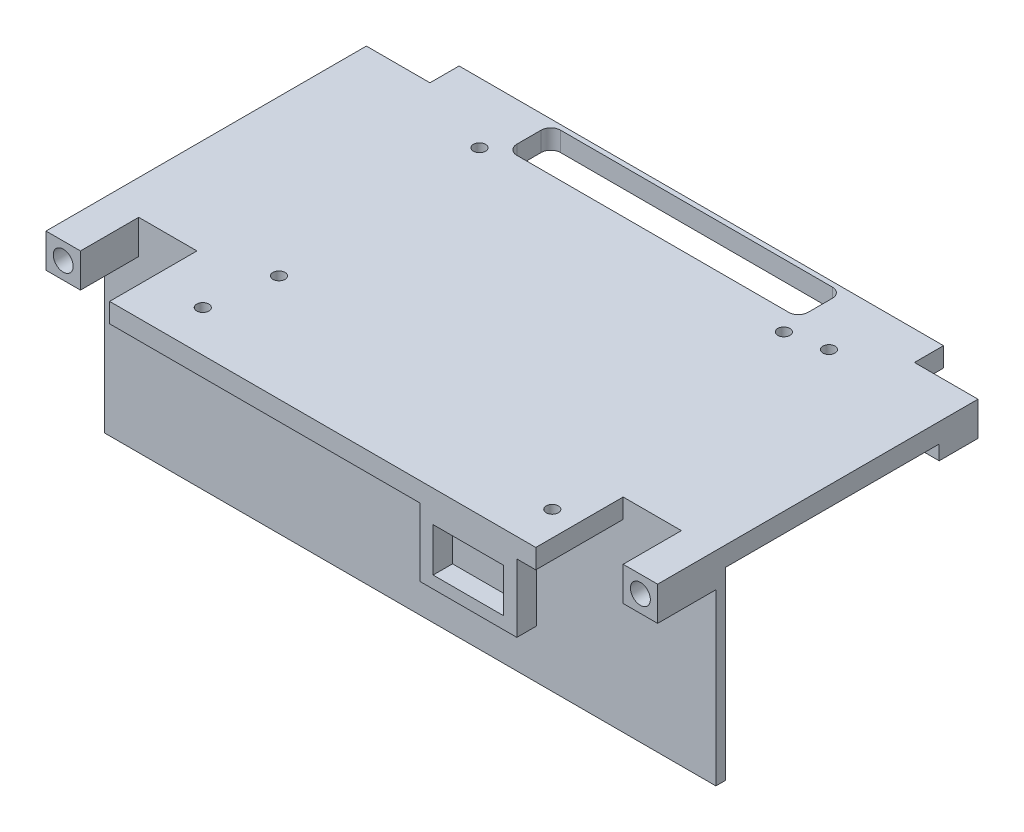
from build123d import *

# Parameters (mm, degrees)
BOSS_EXTRUDE1_DEPTH             = 4
SKETCH3_W                       = 7.1
SKETCH3_H                       = 8
BOSS_EXTRUDE3_DEPTH             = 3
SKETCH4_R                       = 2.05
CUT_EXTRUDE1_DEPTH              = 7
MIRROR2_COPY_1_SKETCH_W         = 7.1
MIRROR2_COPY_1_SKETCH_H         = 8
MIRROR2_COPY_1_DEPTH            = 3
MIRROR2_COPY_2_SKETCH_R         = 2.05
MIRROR2_COPY_2_DEPTH            = 7
SKETCH5_W                       = 60
SKETCH5_H                       = 9
CUT_EXTRUDE2_DEPTH              = 75.953318806
FILLET1_R                       = 2
SKETCH7_W                       = 111.8
SKETCH7_H                       = 1
CUT_EXTRUDE3_DEPTH              = 75.953318806
SKETCH8_W                       = 126
SKETCH8_H                       = 2
BOSS_EXTRUDE4_DEPTH             = 38
SKETCH9_W                       = 12
SKETCH9_H                       = 18
CUT_EXTRUDE4_DEPTH              = 10
SKETCH10_W                      = 7.1
SKETCH10_H                      = 4
BOSS_EXTRUDE5_DEPTH             = 3
SKETCH12_W                      = 1.5
SKETCH12_H                      = 4
BOSS_EXTRUDE6_DEPTH             = 2
SKETCH13_W                      = 40
SKETCH13_H                      = 2
BOSS_EXTRUDE7_DEPTH             = 38
SKETCH14_W                      = 1.5
SKETCH14_H                      = 4
BOSS_EXTRUDE8_DEPTH             = 1
BOSS_EXTRUDE9_REACH             = 85.271
BOSS_EXTRUDE9_DIRECTION_2_REACH = 85.271
SKETCH16_W                      = 20
SKETCH16_H                      = 14
SKETCH16_W_2                    = 14.5
SKETCH16_H_2                    = 9
BOSS_EXTRUDE10_DEPTH            = 4
SKETCH17_W                      = 12
SKETCH17_H                      = 18
CUT_EXTRUDE5_DEPTH              = 84.270643086
SKETCH18_W                      = 6
SKETCH18_H                      = 6
CUT_EXTRUDE6_DEPTH              = 86.170417399
SKETCH22_R                      = 1.25
CUT_EXTRUDE7_DEPTH              = 4
SKETCH25_W                      = 6
SKETCH25_H                      = 38
CUT_EXTRUDE11_DEPTH             = 10
CUT_EXTRUDE12_DEPTH             = 85.029756634
CUT_EXTRUDE12_DEPTH_BACK        = 85.029756634
SKETCH26_W                      = 5.701552738
SKETCH26_H                      = 30.562488548
SKETCH26_W_2                    = 7.53419365
SKETCH26_H_2                    = 28.524331859
SKETCH27_R                      = 1.25
CUT_EXTRUDE13_DEPTH             = 86.170417399


with BuildPart() as part:
    # Sketch1 → Boss-Extrude1 (new body)
    with BuildSketch(Plane(origin=(0, 0, 0), x_dir=(1, 0, 0), z_dir=(0, 1, 0))):
        Polygon((-63, -33), (-55.9, -33), (-55.9, -40), (55.9, -40), (55.9, -33), (63, -33), (63, 33), (55.9, 33), (55.9, 40), (-55.9, 40), (-55.9, 33), (-63, 33), align=None)
    extrude(amount=BOSS_EXTRUDE1_DEPTH)

    # Sketch3 → Boss-Extrude3 (add)
    with BuildSketch(Plane.XZ):
        with Locations((-59.45, -29)):
            Rectangle(SKETCH3_W, SKETCH3_H)
    boss_extrude3 = extrude(amount=BOSS_EXTRUDE3_DEPTH)

    # Sketch4 → Cut-Extrude1 (cut)
    with BuildSketch(Plane(origin=(0, 0, -33), x_dir=(-1, 0, 0), z_dir=(0, 0, -1))):
        with Locations((59.45, 0.5)):
            Circle(SKETCH4_R)
    cut_extrude1 = extrude(amount=-CUT_EXTRUDE1_DEPTH, mode=Mode.SUBTRACT)

    # Mirror1: Boss-Extrude3, Cut-Extrude1 across plane
    add(boss_extrude3.mirror(Plane(origin=(0, 0, 0), x_dir=(0, 0, 1), z_dir=(1, 0, 0))))
    add(cut_extrude1.mirror(Plane(origin=(0, 0, 0), x_dir=(0, 0, 1), z_dir=(1, 0, 0))), mode=Mode.SUBTRACT)

    # Mirror2: Boss-Extrude3, Cut-Extrude1 across plane
    add(boss_extrude3.mirror(Plane.XY))
    add(cut_extrude1.mirror(Plane.XY), mode=Mode.SUBTRACT)

    # Mirror2 copy 1 sketch → Mirror2 copy 1 (add)
    with BuildSketch(Plane(origin=(0, 0, 0), x_dir=(-1, 0, 0), z_dir=(0, -1, 0))):
        with Locations((-59.45, -29)):
            Rectangle(MIRROR2_COPY_1_SKETCH_W, MIRROR2_COPY_1_SKETCH_H)
    extrude(amount=MIRROR2_COPY_1_DEPTH)

    # Mirror2 copy 2 sketch → Mirror2 copy 2 (cut)
    with BuildSketch(Plane.XY.offset(33)):
        with Locations((59.45, 0.5)):
            Circle(MIRROR2_COPY_2_SKETCH_R)
    extrude(amount=-MIRROR2_COPY_2_DEPTH, mode=Mode.SUBTRACT)

    # Sketch5 → Cut-Extrude2 (cut, through all)
    with BuildSketch(Plane(origin=(0, 4, 0), x_dir=(1, 0, 0), z_dir=(0, 1, 0))):
        with Locations((0, 33.5)):
            Rectangle(SKETCH5_W, SKETCH5_H)
    extrude(amount=-CUT_EXTRUDE2_DEPTH, mode=Mode.SUBTRACT)

    # Fillet1
    fillet1_edges = [part.edges().sort_by_distance(p)[0] for p in [
        (-30, 2, -29),
        (-30, 2, -38),
        (30, 2, -38),
        (30, 2, -29),
    ]]
    fillet(fillet1_edges, radius=FILLET1_R)

    # Sketch7 → Cut-Extrude3 (cut, through all)
    with BuildSketch(Plane(origin=(0, 4, 0), x_dir=(1, 0, 0), z_dir=(0, 1, 0))):
        with Locations((0, 39.5)):
            Rectangle(SKETCH7_W, SKETCH7_H)
        with Locations((0, -39.5)):
            Rectangle(SKETCH7_W, SKETCH7_H)
    extrude(amount=-CUT_EXTRUDE3_DEPTH, mode=Mode.SUBTRACT)

    # Sketch8 → Boss-Extrude4 (add)
    with BuildSketch(Plane.XZ):
        with Locations((0, 20)):
            Rectangle(SKETCH8_W, SKETCH8_H)
    extrude(amount=BOSS_EXTRUDE4_DEPTH)

    # Sketch9 → Cut-Extrude4 (cut)
    with BuildSketch(Plane(origin=(0, 4, 0), x_dir=(1, 0, 0), z_dir=(0, 1, 0))):
        with Locations((-49.9, -30)):
            Rectangle(SKETCH9_W, SKETCH9_H)
    extrude(amount=-CUT_EXTRUDE4_DEPTH, mode=Mode.SUBTRACT)

    # Sketch10 → Boss-Extrude5 (add)
    with BuildSketch(Plane.XZ.offset(3)):
        with Locations((-59.45, 23)):
            Rectangle(SKETCH10_W, SKETCH10_H)
        with Locations((59.45, 23)):
            Rectangle(SKETCH10_W, SKETCH10_H)
    extrude(amount=-BOSS_EXTRUDE5_DEPTH)

    # Sketch12 → Boss-Extrude6 (add)
    # profile 1 of 2: a face of its own
    with BuildSketch(Plane.ZY.offset(56)):
        Polygon((21, -5.8), (21, -16.2), (23.7, -13.5), (23.7, -8.5), align=None)
        with Locations((22.35, -11)):
            Rectangle(SKETCH12_W, SKETCH12_H, mode=Mode.SUBTRACT)
    # profile 2 of 2: a face of its own
    with BuildSketch(Plane.ZY.offset(56)):
        Polygon((21, -20.8), (21, -31.2), (23.7, -28.5), (23.7, -23.5), align=None)
        with Locations((22.35, -26)):
            Rectangle(SKETCH12_W, SKETCH12_H, mode=Mode.SUBTRACT)
    boss_extrude6 = extrude(amount=-BOSS_EXTRUDE6_DEPTH)

    # Mirror3: Boss-Extrude6 across plane
    add(boss_extrude6.mirror(Plane(origin=(-49.9, 0, 0), x_dir=(0, 0, 1), z_dir=(1, 0, 0))))

    # Sketch13 → Boss-Extrude7 (add)
    with BuildSketch(Plane.XZ):
        with Locations((0, -20.5)):
            Rectangle(SKETCH13_W, SKETCH13_H)
    extrude(amount=BOSS_EXTRUDE7_DEPTH)

    # Sketch14 → Boss-Extrude8 (add, symmetric)
    # profile 1 of 2: a face of its own
    with BuildSketch(Plane(origin=(0, 0, 0), x_dir=(0, 0, -1), z_dir=(1, 0, 0))):
        Polygon((24.2, -8.5), (21.5, -5.8), (21.5, -16.2), (24.2, -13.5), align=None)
        with Locations((22.85, -11)):
            Rectangle(SKETCH14_W, SKETCH14_H, mode=Mode.SUBTRACT)
    # profile 2 of 2: a face of its own
    with BuildSketch(Plane(origin=(0, 0, 0), x_dir=(0, 0, -1), z_dir=(1, 0, 0))):
        Polygon((24.2, -28.5), (24.2, -23.5), (21.5, -20.8), (21.5, -31.2), align=None)
        with Locations((22.85, -26)):
            Rectangle(SKETCH14_W, SKETCH14_H, mode=Mode.SUBTRACT)
    extrude(amount=BOSS_EXTRUDE8_DEPTH, both=True)

    # Boss-Extrude9: up to this face of the body (flat: up to its plane)
    boss_extrude9_end = Plane(part.part.faces().sort_by_distance((-20, -19, -20.5))[0])
    # Sketch15 → Boss-Extrude9 (add, up to the picked face)
    with BuildSketch(Plane(origin=(0, 0, 0), x_dir=(0, 0, -1), z_dir=(1, 0, 0)), mode=Mode.PRIVATE) as boss_extrude9_sk1:
        Polygon((19.5, 0), (19.5, -5), (16.613248654, 0), align=None)
    boss_extrude9_tool1 = split(extrude(boss_extrude9_sk1.sketch, amount=-BOSS_EXTRUDE9_REACH, mode=Mode.PRIVATE), bisect_by=boss_extrude9_end, keep=Keep.BOTH, mode=Mode.PRIVATE)
    add(boss_extrude9_tool1.solids().sort_by(Axis((0, -1.666667, -18.53775), (-1, 0, 0)))[0])

    # Boss-Extrude9 direction 2: up to this face of the body (flat: up to its plane)
    boss_extrude9_direction_2_end = Plane(part.part.faces().sort_by_distance((20, -19, -20.5))[0])
    # Sketch15 → Boss-Extrude9 direction 2 (add, up to the picked face)
    with BuildSketch(Plane(origin=(0, 0, 0), x_dir=(0, 0, -1), z_dir=(1, 0, 0)), mode=Mode.PRIVATE) as boss_extrude9_direction_2_sk1:
        Polygon((19.5, 0), (19.5, -5), (16.613248654, 0), align=None)
    boss_extrude9_direction_2_tool1 = split(extrude(boss_extrude9_direction_2_sk1.sketch, amount=BOSS_EXTRUDE9_DIRECTION_2_REACH, mode=Mode.PRIVATE), bisect_by=boss_extrude9_direction_2_end, keep=Keep.BOTH, mode=Mode.PRIVATE)
    add(boss_extrude9_direction_2_tool1.solids().sort_by(Axis((0, -1.666667, -18.53775), (1, 0, 0)))[0])

    # Sketch16 → Boss-Extrude10 (add)
    with BuildSketch(Plane.XY.offset(39)):
        with Locations((30, -7)):
            Rectangle(SKETCH16_W, SKETCH16_H)
        with Locations((30, -7)):
            Rectangle(SKETCH16_W_2, SKETCH16_H_2, mode=Mode.SUBTRACT)
    extrude(amount=-BOSS_EXTRUDE10_DEPTH)

    # Sketch17 → Cut-Extrude5 (cut, through all)
    with BuildSketch(Plane.XZ):
        with Locations((49.9, 30)):
            Rectangle(SKETCH17_W, SKETCH17_H)
    extrude(amount=-CUT_EXTRUDE5_DEPTH, mode=Mode.SUBTRACT)

    # Sketch18 → Cut-Extrude6 (cut, through all)
    with BuildSketch(Plane(origin=(0, 4, 0), x_dir=(1, 0, 0), z_dir=(0, 1, 0))):
        with Locations((52.9, 36)):
            Rectangle(SKETCH18_W, SKETCH18_H)
        with Locations((-52.9, 36)):
            Rectangle(SKETCH18_W, SKETCH18_H)
    extrude(amount=-CUT_EXTRUDE6_DEPTH, mode=Mode.SUBTRACT)

    # Sketch22 → Cut-Extrude7 (cut)
    with BuildSketch(Plane(origin=(0, 4, 0), x_dir=(1, 0, 0), z_dir=(0, 1, 0))):
        with Locations(Location((31, 25, 0), (0, 0, 270))):
            Circle(SKETCH22_R)
        with Locations(Location((-31, -17, 0), (0, 0, 270))):
            Circle(SKETCH22_R)
    extrude(amount=-CUT_EXTRUDE7_DEPTH, mode=Mode.SUBTRACT)

    # Sketch25 → Cut-Extrude11 (cut)
    with BuildSketch(Plane(origin=(0, 0, -21.5), x_dir=(-1, 0, 0), z_dir=(0, 0, -1))):
        with Locations((-17, -19)):
            Rectangle(SKETCH25_W, SKETCH25_H)
        with Locations((17, -19)):
            Rectangle(SKETCH25_W, SKETCH25_H)
    extrude(amount=-CUT_EXTRUDE11_DEPTH, mode=Mode.SUBTRACT)

    # Sketch26 → Cut-Extrude12 (cut, two sides: drawn at the far end of the back side and taken through both)
    with BuildSketch(Plane.ZY.offset(1).offset(-CUT_EXTRUDE12_DEPTH_BACK)):
        with Locations((-24.350776369, -21.081244274)):
            Rectangle(SKETCH26_W, SKETCH26_H)
        with Locations((24.767096825, -20.06216593)):
            Rectangle(SKETCH26_W_2, SKETCH26_H_2)
    extrude(amount=CUT_EXTRUDE12_DEPTH + CUT_EXTRUDE12_DEPTH_BACK, mode=Mode.SUBTRACT)

    # Sketch27 → Cut-Extrude13 (cut, through all)
    with BuildSketch(Plane(origin=(0, 4, 0), x_dir=(1, 0, 0), z_dir=(0, 1, 0))):
        with Locations(Location((-33.2, 26.5, 0), (0, 0, 270))):
            Circle(SKETCH27_R)
        with Locations(Location((-33.2, -30.5, 0), (0, 0, 270))):
            Circle(SKETCH27_R)
        with Locations(Location((38.8, -30.5, 0), (0, 0, 270))):
            Circle(SKETCH27_R)
        with Locations(Location((38.8, 26.5, 0), (0, 0, 270))):
            Circle(SKETCH27_R)
    extrude(amount=-CUT_EXTRUDE13_DEPTH, mode=Mode.SUBTRACT)


solid = part.part
